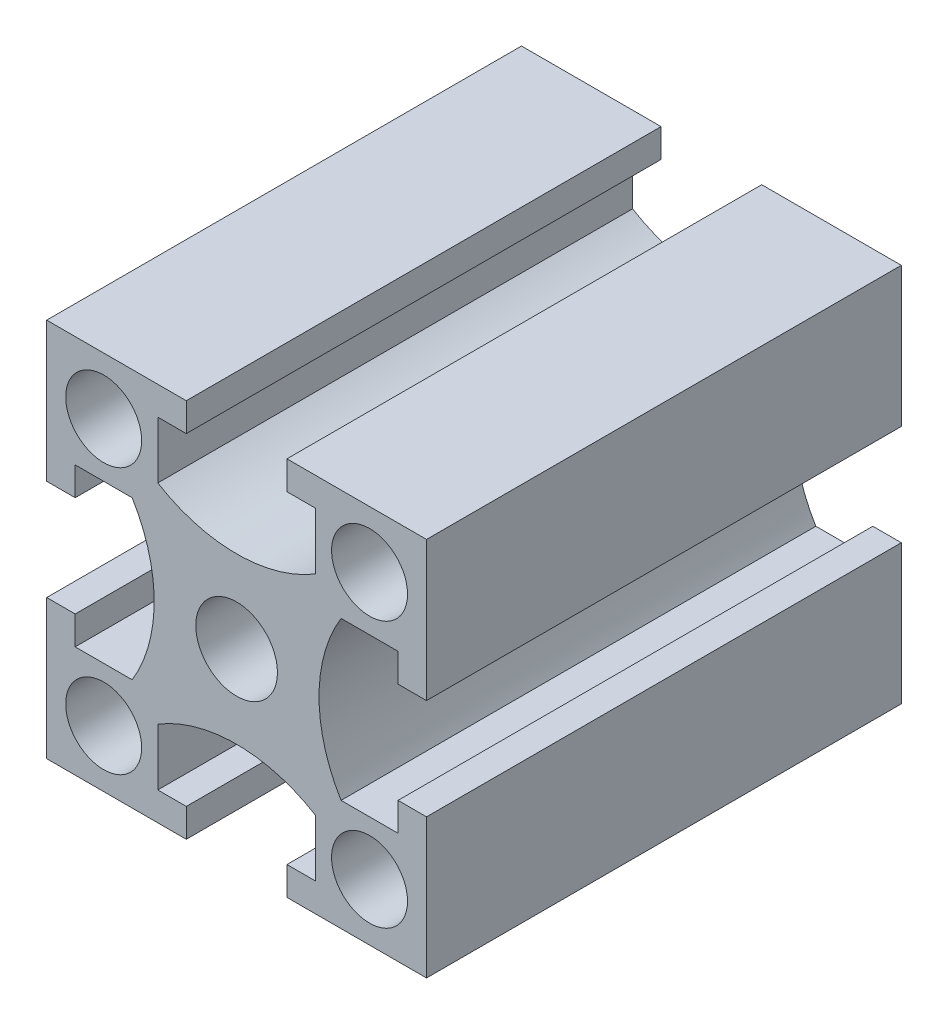
from build123d import *

# Parameters (mm, degrees)
SKETCH_1_W          = 20
SKETCH_1_H          = 20
EXTRUDE_1_DEPTH     = 25
SKETCH_2_R          = 2.15
SKETCH_2_R_2        = 2
CUT_EXTRUDE_1_DEPTH = 300


with BuildPart() as part:
    # 스케치1 → 보스-돌출1 (new body)
    with BuildSketch(Plane.XY):
        Rectangle(SKETCH_1_W, SKETCH_1_H)
    extrude(amount=EXTRUDE_1_DEPTH)

    # 스케치2 → 컷-돌출1 (cut)
    with BuildSketch(Plane.XY.offset(25)):
        Circle(SKETCH_2_R)
        with Locations((-7, 7)):
            Circle(SKETCH_2_R_2)
        with Locations((7, 7)):
            Circle(SKETCH_2_R_2)
        with Locations((7, -7)):
            Circle(SKETCH_2_R_2)
        with Locations((-7, -7)):
            Circle(SKETCH_2_R_2)
        with BuildLine():
            Line((-2.65, 10), (-2.65, 8.5))
            Line((-2.65, 8.5), (-4.15, 8.5))
            Line((-4.15, 8.5), (-4.15, 5.5))
            ThreePointArc((-4.15, 5.5), (0, 4.339407869), (4.15, 5.5))
            Line((4.15, 5.5), (4.15, 8.5))
            Line((4.15, 8.5), (2.65, 8.5))
            Line((2.65, 8.5), (2.65, 10))
            Line((2.65, 10), (-2.65, 10))
        make_face()
        with BuildLine():
            Line((10, 2.65), (8.5, 2.65))
            Line((8.5, 2.65), (8.5, 4.15))
            Line((8.5, 4.15), (5.5, 4.15))
            ThreePointArc((5.5, 4.15), (4.339407869, 0), (5.5, -4.15))
            Line((5.5, -4.15), (8.5, -4.15))
            Line((8.5, -4.15), (8.5, -2.65))
            Line((8.5, -2.65), (10, -2.65))
            Line((10, -2.65), (10, 2.65))
        make_face()
        with BuildLine():
            Line((2.65, -10), (2.65, -8.5))
            Line((2.65, -8.5), (4.15, -8.5))
            Line((4.15, -8.5), (4.15, -5.5))
            ThreePointArc((4.15, -5.5), (0, -4.339407869), (-4.15, -5.5))
            Line((-4.15, -5.5), (-4.15, -8.5))
            Line((-4.15, -8.5), (-2.65, -8.5))
            Line((-2.65, -8.5), (-2.65, -10))
            Line((-2.65, -10), (2.65, -10))
        make_face()
        with BuildLine():
            Line((-10, -2.65), (-8.5, -2.65))
            Line((-8.5, -2.65), (-8.5, -4.15))
            Line((-8.5, -4.15), (-5.5, -4.15))
            ThreePointArc((-5.5, -4.15), (-4.339407869, 0), (-5.5, 4.15))
            Line((-5.5, 4.15), (-8.5, 4.15))
            Line((-8.5, 4.15), (-8.5, 2.65))
            Line((-8.5, 2.65), (-10, 2.65))
            Line((-10, 2.65), (-10, -2.65))
        make_face()
    extrude(amount=-CUT_EXTRUDE_1_DEPTH, mode=Mode.SUBTRACT)


solid = part.part
